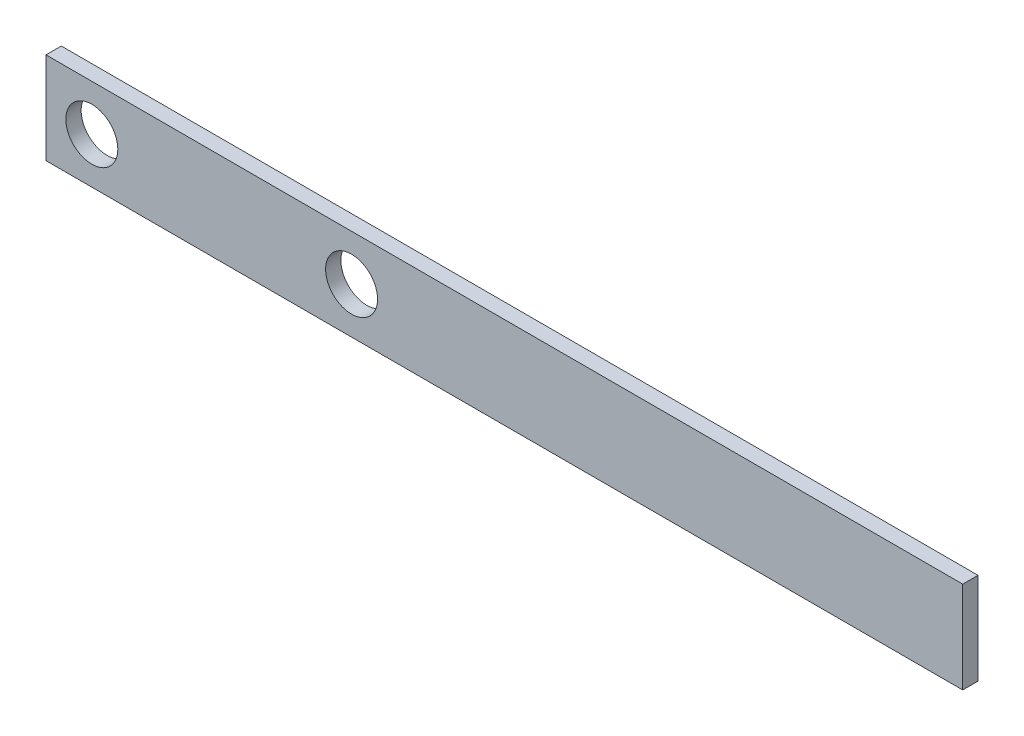
from build123d import *

# Parameters (mm, degrees)
SKETCH1_W            = 60
SKETCH1_H            = 6
BOSS_EXTRUDE1_DEPTH  = 1
M3_CLEARANCE_HOLE1_D = 3.4


with BuildPart() as part:
    # Sketch1 → Boss-Extrude1 (new body)
    with BuildSketch(Plane.XY):
        Rectangle(SKETCH1_W, SKETCH1_H)
    extrude(amount=BOSS_EXTRUDE1_DEPTH)

    # M3 Clearance Hole1 (through all)
    with Locations(Plane.XY.offset(1)):
        with Locations((-27, 0), (-10, 0)):
            Hole(M3_CLEARANCE_HOLE1_D / 2)


solid = part.part
